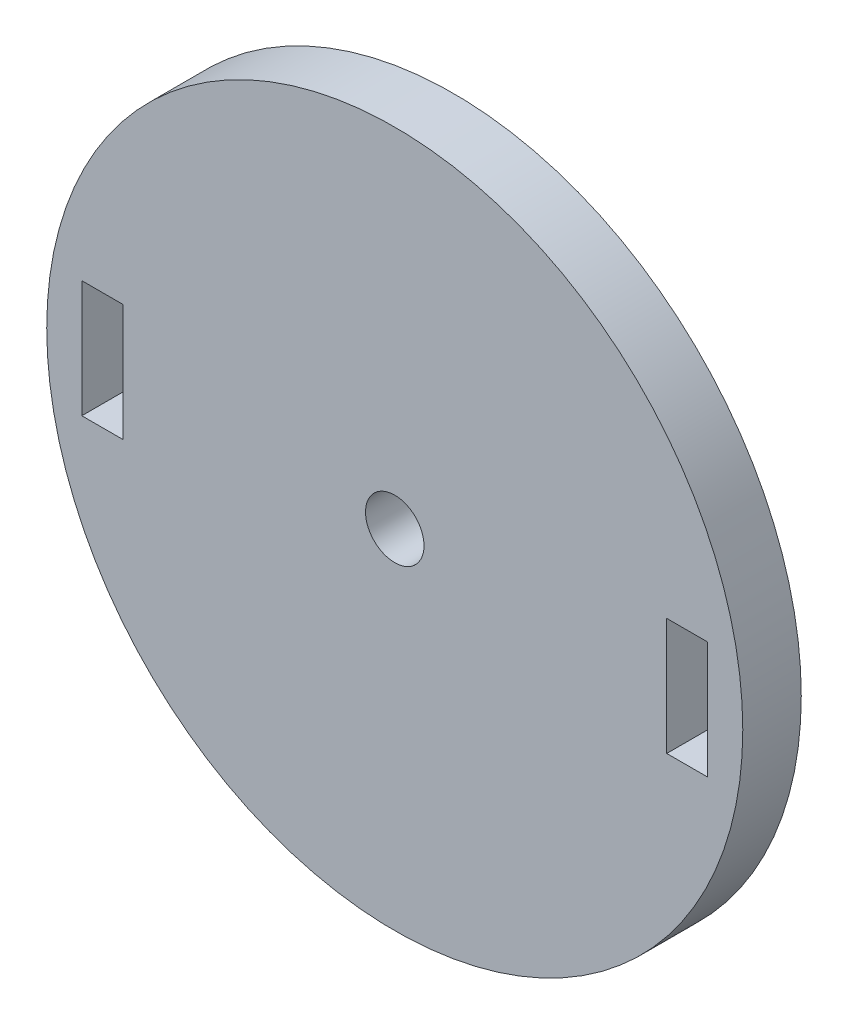
from build123d import *

# Parameters (mm, degrees)
SKETCH1_R           = 11.9
SKETCH1_R_2         = 1
SKETCH1_W           = 1.4
SKETCH1_H           = 4
BOSS_EXTRUDE1_DEPTH = 2


with BuildPart() as part:
    # Sketch1 → Boss-Extrude1 (new body)
    with BuildSketch(Plane.XY):
        with Locations((0.462805042, 1.624450899)):
            Circle(SKETCH1_R)
        with Locations((0.462805042, 1.624450899)):
            Circle(SKETCH1_R_2, mode=Mode.SUBTRACT)
        with Locations((10.462805042, 1.624450899)):
            Rectangle(SKETCH1_W, SKETCH1_H, mode=Mode.SUBTRACT)
        with Locations((-9.537194958, 1.624450899)):
            Rectangle(SKETCH1_W, SKETCH1_H, mode=Mode.SUBTRACT)
    extrude(amount=BOSS_EXTRUDE1_DEPTH)


solid = part.part
